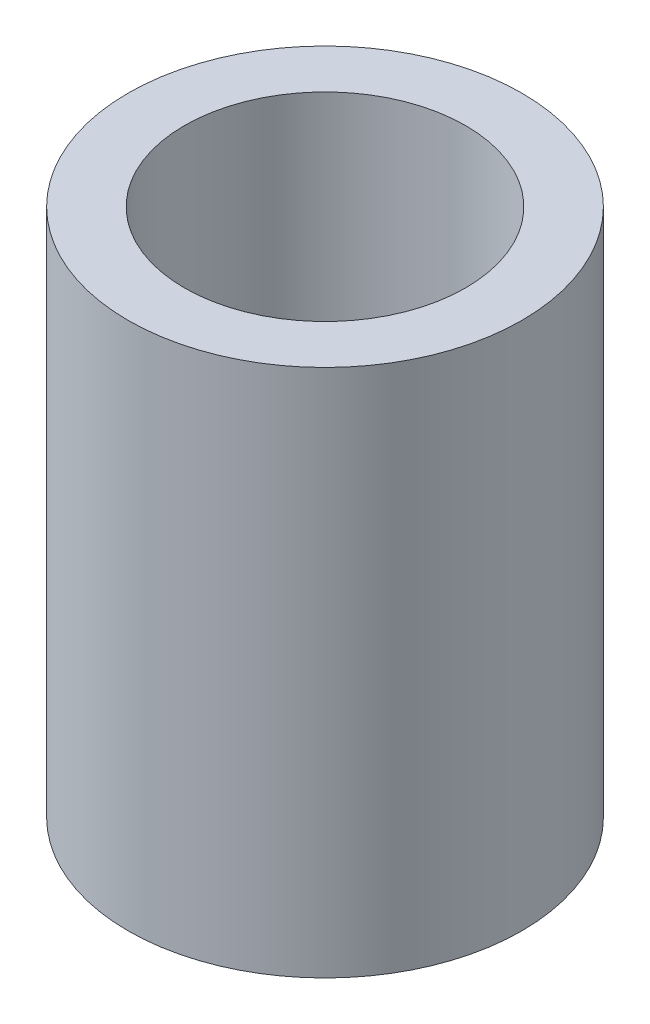
from build123d import *

# Parameters (mm, degrees)
SCHIZZO1_R                = 3.5
SCHIZZO1_R_2              = 2.5
ESTRUSIONE_SOTTILE1_DEPTH = 9.4


with BuildPart() as part:
    # Schizzo1 → Estrusione-Sottile1 (new body)
    with BuildSketch(Plane(origin=(0, 0, 0), x_dir=(1, 0, 0), z_dir=(0, 1, 0))):
        Circle(SCHIZZO1_R)
        Circle(SCHIZZO1_R_2, mode=Mode.SUBTRACT)
    extrude(amount=ESTRUSIONE_SOTTILE1_DEPTH)


solid = part.part
